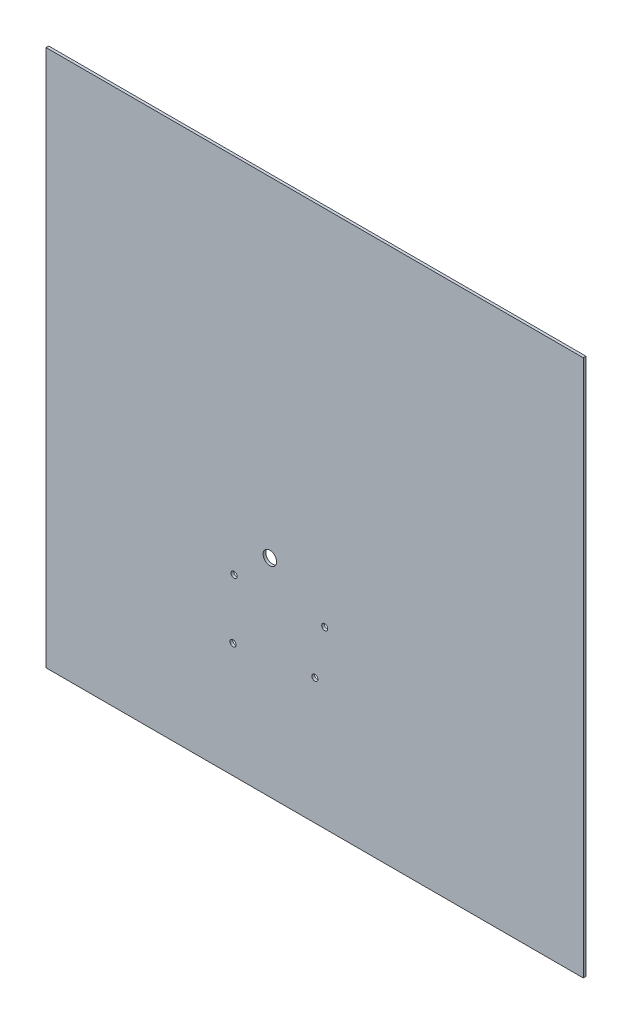
from build123d import *

# Parameters (mm, degrees)
SKETCH_1_W      = 400
SKETCH_1_H      = 400
SKETCH_1_R      = 2.25
SKETCH_1_R_2    = 5
EXTRUDE_1_DEPTH = 2


with BuildPart() as part:
    # 草圖1 → 填料-伸長1 (new body)
    with BuildSketch(Plane.XY):
        with Locations((37.810455637, 222.864864865)):
            Rectangle(SKETCH_1_W, SKETCH_1_H)
        with Locations((-22.189544363, 152.864864865)):
            Circle(SKETCH_1_R, mode=Mode.SUBTRACT)
        with Locations((45.310455637, 152.864864865)):
            Circle(SKETCH_1_R, mode=Mode.SUBTRACT)
        with Locations((37.974272683, 116.599448561)):
            Circle(SKETCH_1_R, mode=Mode.SUBTRACT)
        with Locations((-22.972877697, 108.371759906)):
            Circle(SKETCH_1_R, mode=Mode.SUBTRACT)
        with Locations((4.447492674, 177.081971585)):
            Circle(SKETCH_1_R_2, mode=Mode.SUBTRACT)
    extrude(amount=EXTRUDE_1_DEPTH)


solid = part.part
